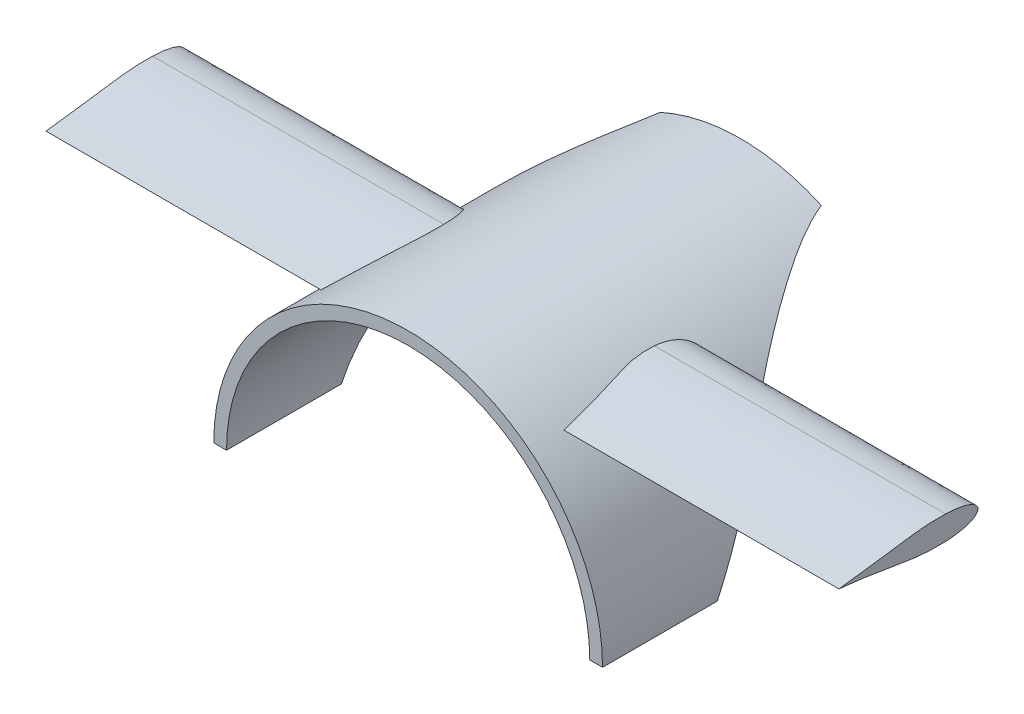
from build123d import *

# Parameters (mm, degrees)
REARWINGBASE_DEPTH   = 26
CLEARENCE_DEPTH      = 26
CLEARENCE_DEPTH_BACK = 26
REARWING_DEPTH       = 31
REARWING_DEPTH_BACK  = 31
CLEARENCE2_START     = -26
SKETCH10_R           = 14.2
CLEARENCE2_DEPTH     = 26


with BuildPart() as part:
    # Sketch4 → RearWingBase (new body)
    with BuildSketch(Plane.XY):
        with BuildLine():
            Line((-15.2, 0), (-14.2, 0))
            ThreePointArc((-14.2, 0), (0, 14.2), (14.2, 0))
            Line((14.2, 0), (15.2, 0))
            ThreePointArc((15.2, 0), (0, 15.2), (-15.2, 0))
        make_face()
    extrude(amount=REARWINGBASE_DEPTH)

    # Sketch6 → Clearence (cut, two sides: drawn at the far end of the back side and taken through both)
    with BuildSketch(Plane(origin=(0, 0, 0), x_dir=(0, 0, -1), z_dir=(1, 0, 0)).offset(-CLEARENCE_DEPTH_BACK)):
        with BuildLine():
            Line((0.002719324, 15.197805772), (0.002719324, 13.829604024))
            add(Edge.make_bspline(
                [(0, 13.829225922), (0.000906491, 13.829352033), (0.001812932, 13.829478067), (0.002719324, 13.829604024)],
                knots=[0.999883326, 0.999883326, 0.999883326, 0.999883326, 1, 1, 1, 1], degree=3))
            add(Edge.make_bspline(
                [(-19.095204108, -5.766909468), (-17.667809088, -0.279268361), (-14.718368277, 4.473703473), (-9.162118992, 11.138171669), (-3.698103032, 13.314743837), (0, 13.829225922)],
                knots=[0, 0, 0, 0, 0.423900901, 0.523900901, 0.999883326, 0.999883326, 0.999883326, 0.999883326], degree=3))
            Line((-19.095204108, -5.766909468), (5.416214623, -5.766909468))
            Line((5.416214623, -5.766909468), (5.416214623, 15.197805772))
            Line((5.416214623, 15.197805772), (0.002719324, 15.197805772))
        make_face()
    extrude(amount=CLEARENCE_DEPTH + CLEARENCE_DEPTH_BACK, mode=Mode.SUBTRACT)

    # Sketch7 → RearWing (add, two sides: drawn at the far end of the back side and taken through both)
    with BuildSketch(Plane(origin=(0, 0, 0), x_dir=(0, 0, -1), z_dir=(1, 0, 0)).offset(-REARWING_DEPTH_BACK)):
        with BuildLine():
            add(Edge.make_bspline(
                [(-23.31622835, 11.867098708), (-21.717058728, 12.055213608), (-17.709554302, 12.634200705), (-16.496163082, 12.809494118), (-14.984125288, 12.779042837)],
                knots=[0, 0, 0, 0, 0.450119824, 1, 1, 1, 1], degree=3))
            add(Edge.make_bspline(
                [(-14.984125288, 12.779042837), (-11.626410325, 12.668851451), (-11.573129472, 11.081257235), (-14.968657337, 10.907420766)],
                knots=[0, 0, 0, 0, 1, 1, 1, 1], degree=3))
            add(Edge.make_bspline(
                [(-23.31622835, 11.867098708), (-19.356721106, 11.506371016), (-17.965634836, 10.821641279), (-14.968657337, 10.907420766)],
                knots=[0, 0, 0, 0, 1, 1, 1, 1], degree=3))
        make_face()
    extrude(amount=REARWING_DEPTH + REARWING_DEPTH_BACK)

    # Sketch10 → Clearence2 (cut)
    with BuildSketch(Plane.XY.offset(26).offset(CLEARENCE2_START)):
        Circle(SKETCH10_R)
    extrude(amount=CLEARENCE2_DEPTH, mode=Mode.SUBTRACT)


solid = part.part
